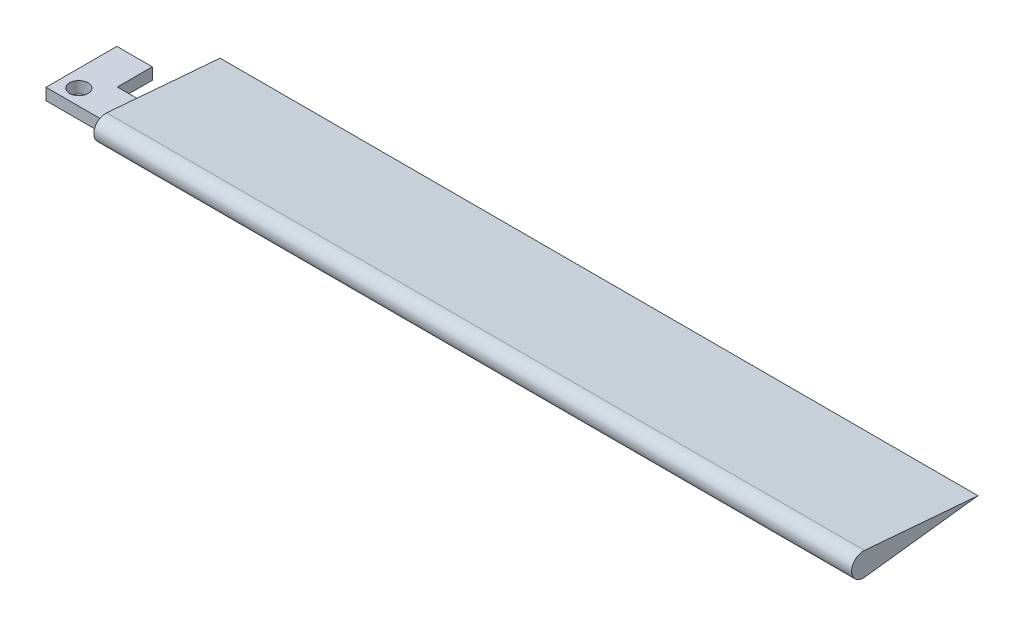
from build123d import *

# Parameters (mm, degrees)
BOSS_EXTRUDE2_DEPTH = 130
SKETCH3_W           = 6.156004655
SKETCH3_H           = 2
BOSS_EXTRUDE3_DEPTH = 10
SKETCH4_W           = 6.077661346
SKETCH4_H           = 2
BOSS_EXTRUDE4_DEPTH = 6
SKETCH5_R           = 1.5875
CUT_EXTRUDE1_DEPTH  = 132.968640925


with BuildPart() as part:
    # Sketch2 → Boss-Extrude2 (new body)
    with BuildSketch(Plane(origin=(0, 0, 0), x_dir=(0, 0, -1), z_dir=(1, 0, 0))):
        with BuildLine():
            Line((-0.835960879, 1.603184904), (-20.29416291, 3.210740854))
            ThreePointArc((-20.29416291, 3.210740854), (-22.509098324, 1.210740854), (-20.29416291, -0.789259146))
            Line((-20.29416291, -0.789259146), (-0.835960879, 1.603184904))
        make_face()
    extrude(amount=BOSS_EXTRUDE2_DEPTH)

    # Sketch3 → Boss-Extrude3 (add)
    with BuildSketch(Plane.ZY):
        with Locations((17.625252135, 1.210740854)):
            Rectangle(SKETCH3_W, SKETCH3_H)
    extrude(amount=BOSS_EXTRUDE3_DEPTH)

    # Sketch4 → Boss-Extrude4 (add)
    with BuildSketch(Plane(origin=(0, 0, 14.547249808), x_dir=(-1, 0, 0), z_dir=(0, 0, -1))):
        with Locations((6.961169327, 1.210740854)):
            Rectangle(SKETCH4_W, SKETCH4_H)
    extrude(amount=BOSS_EXTRUDE4_DEPTH)

    # Sketch5 → Cut-Extrude1 (cut, through all)
    with BuildSketch(Plane(origin=(0, 2.210740854, 0), x_dir=(1, 0, 0), z_dir=(0, 1, 0))):
        with Locations(Location((-7.057411019, -18.017090399, 0), (0, 0, 270))):
            Circle(SKETCH5_R)
    extrude(amount=-CUT_EXTRUDE1_DEPTH, mode=Mode.SUBTRACT)


solid = part.part
